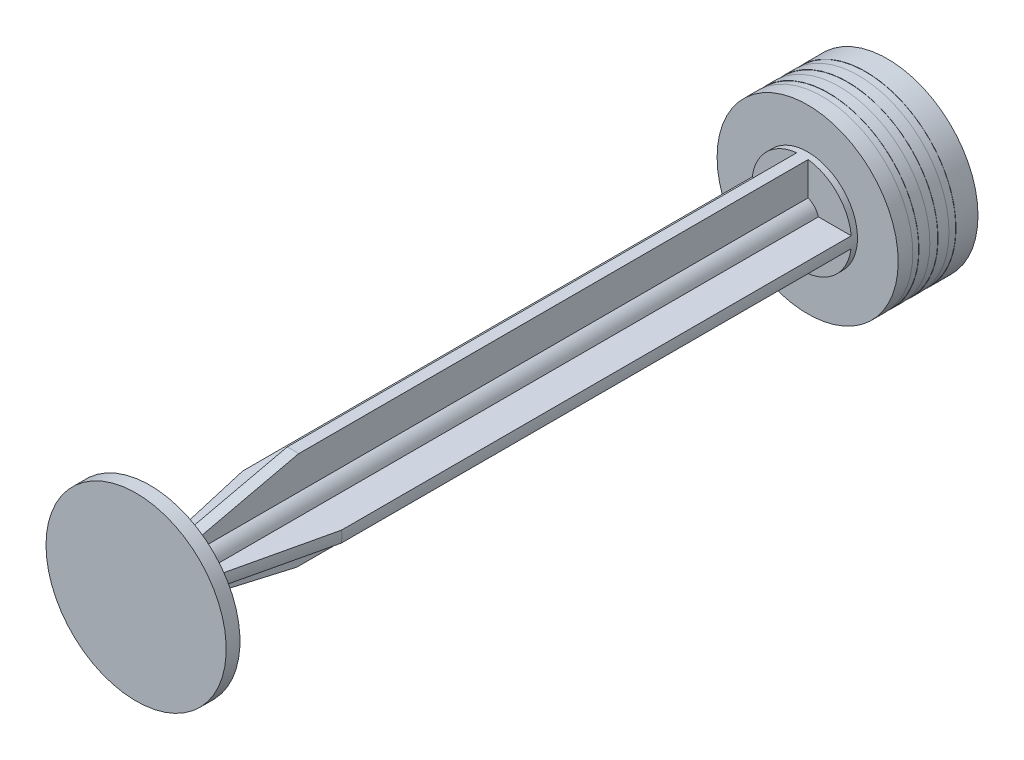
from build123d import *

# Parameters (mm, degrees)
SKETCH2_R           = 6.806368693
BOSS_EXTRUDE1_DEPTH = 6
CUT_EXTRUDE1_DEPTH  = 49
SKETCH5_W           = 0.469385106
SKETCH5_H           = 0.019240939
SKETCH5_W_2         = 0.618798201
SKETCH5_W_3         = 0.526460496
SKETCH7_R           = 0.854461161
CUT_EXTRUDE2_DEPTH  = 10


with BuildPart() as part:
    # Sketch2 → Boss-Extrude1 (new body)
    with BuildSketch(Plane.XY.offset(-44.302178105)):
        with Locations((-124.156373602, -50.798156381)):
            Circle(SKETCH2_R)
    extrude(amount=-BOSS_EXTRUDE1_DEPTH)

    # Sketch3 → Revolve1 (revolve)
    with BuildSketch(Plane.ZY.offset(124.156373602), mode=Mode.PRIVATE) as revolve1_sk:
        Polygon((-44.302178105, -50.798156381), (6.183197751, -50.798156381), (6.183197751, -44.024347355), (5.148759689, -44.024347355), (5.148759689, -49.48766214), (-5.538916802, -47.052727869), (-44.302178105, -47.052727869), align=None)
    revolve(revolve1_sk.sketch.rotate(Axis((-124.156373602, -50.798156381, -44.302178105), (0, 0, 1)), 90), axis=Axis((-124.156373602, -50.798156381, -44.302178105), (0, 0, 1)))

    # Sketch4 → Cut-Extrude1 (cut)
    with BuildSketch(Plane(origin=(0, 0, 5.148759689), x_dir=(-1, 0, 0), z_dir=(0, 0, -1))):
        with BuildLine():
            ThreePointArc((122.898541187, -50.430389102), (123.18629962, -49.917048201), (123.669679719, -49.581388441))
            Line((123.669679719, -49.581388441), (123.669679719, -46.278106739))
            ThreePointArc((123.669679719, -46.278106739), (120.899785056, -47.626035521), (119.625097078, -50.430389102))
            Line((119.625097078, -50.430389102), (122.898541187, -50.430389102))
        make_face()
        with BuildLine():
            Line((124.524140881, -46.266879857), (124.524140881, -49.540323966))
            ThreePointArc((124.524140881, -49.540323966), (125.037481781, -49.828082399), (125.373141541, -50.311462498))
            Line((125.373141541, -50.311462498), (128.676423243, -50.311462498))
            ThreePointArc((128.676423243, -50.311462498), (127.328494461, -47.541567835), (124.524140881, -46.266879857))
        make_face()
        with BuildLine():
            Line((128.687650125, -51.16592366), (125.414206016, -51.16592366))
            ThreePointArc((125.414206016, -51.16592366), (125.126447583, -51.67926456), (124.643067484, -52.01492432))
            Line((124.643067484, -52.01492432), (124.643067484, -55.318206023))
            ThreePointArc((124.643067484, -55.318206023), (127.412962147, -53.97027724), (128.687650125, -51.16592366))
        make_face()
        with BuildLine():
            ThreePointArc((123.788606323, -52.055988795), (123.275265422, -51.768230362), (122.939605662, -51.284850263))
            Line((122.939605662, -51.284850263), (119.63632396, -51.284850263))
            ThreePointArc((119.63632396, -51.284850263), (120.984252742, -54.054744926), (123.788606323, -55.329432904))
            Line((123.788606323, -55.329432904), (123.788606323, -52.055988795))
        make_face()
    extrude(amount=CUT_EXTRUDE1_DEPTH, mode=Mode.SUBTRACT)

    # Sketch5 → Cut-Revolve2 (revolve, cut)
    with BuildSketch(Plane.ZY.offset(124.156373602), mode=Mode.PRIVATE) as cut_revolve2_sk:
        with Locations((-45.635234776, -44.001408158)):
            Rectangle(SKETCH5_W, SKETCH5_H)
        with Locations((-46.992779005, -44.001408158)):
            Rectangle(SKETCH5_W_2, SKETCH5_H)
        with Locations((-48.389416848, -44.001408158)):
            Rectangle(SKETCH5_W_3, SKETCH5_H)
    revolve(cut_revolve2_sk.sketch.rotate(Axis((-124.156373602, -50.798156381, -50.302178105), (0, 0, 1)), 270), axis=Axis((-124.156373602, -50.798156381, -50.302178105), (0, 0, 1)), mode=Mode.SUBTRACT)

    # Sketch7 → Cut-Extrude2 (cut)
    with BuildSketch(Plane(origin=(0, -50.430389102, 0), x_dir=(1, 0, 0), z_dir=(0, 1, 0))):
        with Locations(Location((-123.669679719, -2.475298292, 0), (0, 0, 98.000581908))):
            Circle(SKETCH7_R)
    extrude(amount=-CUT_EXTRUDE2_DEPTH, mode=Mode.SUBTRACT)


solid = part.part
